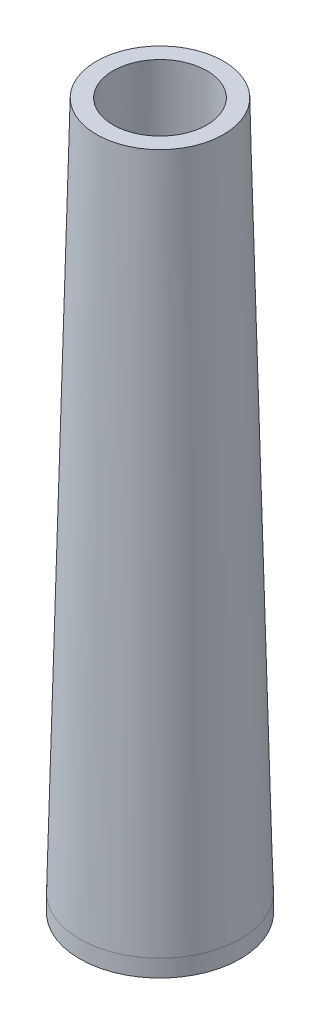
from build123d import *

# Parameters (mm, degrees)
CROQUIS1_R              = 14
SALIENTE_EXTRUIR1_DEPTH = 3
CROQUIS2_R              = 11.075
SALIENTE_EXTRUIR2_DEPTH = 120
CROQUIS10_R             = 9
CORTAR_EXTRUIR1_DEPTH   = 125.583305463


with BuildPart() as part:
    # Croquis1 → Saliente-Extruir1 (new body)
    with BuildSketch(Plane(origin=(0, 0, 0), x_dir=(1, 0, 0), z_dir=(0, 1, 0))):
        with Locations(Location((0, 0, 0), (0, 0, 270))):
            Circle(CROQUIS1_R)
    extrude(amount=SALIENTE_EXTRUIR1_DEPTH)

    # Croquis2 → Saliente-Extruir2 (add)
    with BuildSketch(Plane(origin=(0, 3, 0), x_dir=(1, 0, 0), z_dir=(0, 1, 0))):
        with Locations(Location((0, 0, 0), (0, 0, 270))):
            Circle(CROQUIS2_R)
    extrude(amount=SALIENTE_EXTRUIR2_DEPTH)

    # Croquis4 → Revolución1 (revolve)
    with BuildSketch(Plane.XY, mode=Mode.PRIVATE) as revoluci_n1_sk:
        Polygon((14, 3), (11.075, 3), (11.075, 123), align=None)
    revolve(revoluci_n1_sk.sketch.rotate(Axis((0, 0, 0), (0, 1, 0)), 90), axis=Axis((0, 0, 0), (0, 1, 0)))

    # Croquis10 → Cortar-Extruir1 (cut, through all)
    with BuildSketch(Plane(origin=(0, 123, 0), x_dir=(1, 0, 0), z_dir=(0, 1, 0))):
        with Locations(Location((0, 0, 0), (0, 0, 270))):
            Circle(CROQUIS10_R)
    extrude(amount=-CORTAR_EXTRUIR1_DEPTH, mode=Mode.SUBTRACT)

    # Croquis11 → Revolución2 (revolve)
    with BuildSketch(Plane.XY, mode=Mode.PRIVATE) as revoluci_n2_sk:
        Polygon((9, 123), (9, 105), (8.182624783, 123), align=None)
    revolve(revoluci_n2_sk.sketch.rotate(Axis((0, 123, 0), (0, -1, 0)), 90), axis=Axis((0, 123, 0), (0, -1, 0)))


solid = part.part
